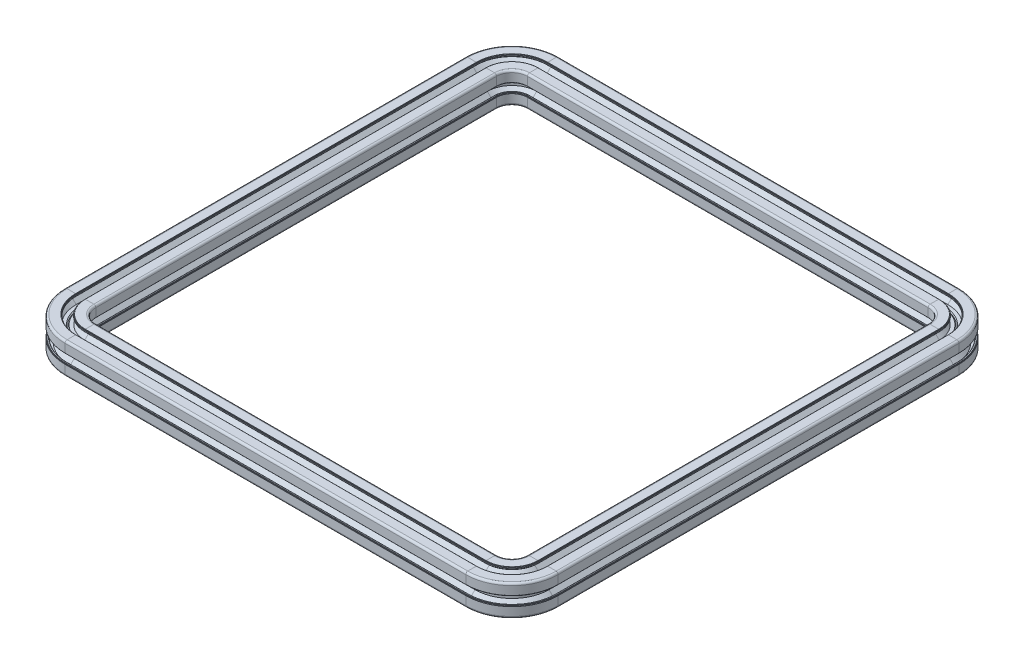
from build123d import *

# Parameters (mm, degrees)
SKETCH1_R                                      = 3.65
C_PROGRAM_FILES_SOLIDWORKS_CORP_SOLIDWOR_DEPTH = 390
SKETCH1_ON_SEGMENT_2_R                         = 3.65
C_PROGRAM_FILES_SOLIDWORKS_CORP_SOLI_2_ANGLE   = 90
SKETCH1_ON_SEGMENT_3_R                         = 3.65
C_PROGRAM_FILES_SOLIDWORKS_CORP_SOLI_3_DEPTH   = 390
SKETCH1_ON_SEGMENT_4_R                         = 3.65
C_PROGRAM_FILES_SOLIDWORKS_CORP_SOLI_4_ANGLE   = 90
SKETCH1_ON_SEGMENT_5_R                         = 3.65
C_PROGRAM_FILES_SOLIDWORKS_CORP_SOLI_5_DEPTH   = 390
SKETCH1_ON_SEGMENT_6_R                         = 3.65
C_PROGRAM_FILES_SOLIDWORKS_CORP_SOLI_6_ANGLE   = 90
SKETCH1_ON_SEGMENT_7_R                         = 3.65
C_PROGRAM_FILES_SOLIDWORKS_CORP_SOLI_7_DEPTH   = 390
SKETCH1_ON_SEGMENT_8_R                         = 3.65
C_PROGRAM_FILES_SOLIDWORKS_CORP_SOLI_8_ANGLE   = 90


with BuildPart() as part:
    # Sketch1 → C_PROGRAM FILES_SOLIDWORKS CORP_SOLIDWOR (new body)
    with BuildSketch(Plane(origin=(-225, 0, -195), x_dir=(1, 0, 0), z_dir=(0, 0, 1))):
        with BuildLine():
            Line((-0.899999946, -6), (0, -5.484851837))
            Line((0, -5.484851837), (0.899999946, -6))
            Line((0.899999946, -6), (4.204466193, -6))
            Line((4.204466193, -6), (8.250000327, -10.049999237))
            Line((8.250000327, -10.049999237), (8.250000327, -12.599998834))
            ThreePointArc((8.250000327, -12.599998834), (8.191421565, -12.741420475), (8.049999924, -12.799999237))
            Line((8.049999924, -12.799999237), (4.650000197, -12.799999237))
            ThreePointArc((4.650000197, -12.799999237), (4.225735989, -12.975735226), (4.05, -13.399999434))
            Line((4.05, -13.399999434), (4.05, -14.299999626))
            ThreePointArc((4.05, -14.299999626), (4.108578753, -14.441421247), (4.250000374, -14.5))
            Line((4.250000374, -14.5), (4.350000144, -14.5))
            ThreePointArc((4.350000144, -14.5), (4.49142109, -14.558578474), (4.549999564, -14.69999942))
            Line((4.549999564, -14.69999942), (4.549999564, -14.799999619))
            ThreePointArc((4.549999564, -14.799999619), (4.60857832, -14.941421245), (4.749999945, -15))
            Line((4.749999945, -15), (13.000000346, -15))
            ThreePointArc((13.000000346, -15), (14.414213664, -14.414213664), (15, -13.000000346))
            Line((15, -13.000000346), (15, -4.749999521))
            ThreePointArc((15, -4.749999521), (14.941421273, -4.608577964), (14.799999716, -4.549999237))
            Line((14.799999716, -4.549999237), (14.700000611, -4.549999237))
            ThreePointArc((14.700000611, -4.549999237), (14.558579054, -4.49142051), (14.500000327, -4.349998953))
            Line((14.500000327, -4.349998953), (14.500000327, -4.249999521))
            ThreePointArc((14.500000327, -4.249999521), (14.4414216, -4.108577964), (14.300000043, -4.049999237))
            Line((14.300000043, -4.049999237), (13.39999994, -4.049999237))
            ThreePointArc((13.39999994, -4.049999237), (12.975735606, -4.225735278), (12.799999564, -4.649999613))
            Line((12.799999564, -4.649999613), (12.799999564, -8.049999716))
            ThreePointArc((12.799999564, -8.049999716), (12.741420837, -8.191421273), (12.59999928, -8.25))
            Line((12.59999928, -8.25), (10.049999564, -8.25))
            Line((10.049999564, -8.25), (6.00446543, -4.204465866))
            Line((6.00446543, -4.204465866), (6.00446543, -0.899999619))
            Line((6.00446543, -0.899999619), (5.484852164, 0))
            Line((5.484852164, 0), (6.00446543, 0.899999619))
            Line((6.00446543, 0.899999619), (6.00446543, 4.204465866))
            Line((6.00446543, 4.204465866), (10.049999564, 8.25))
            Line((10.049999564, 8.25), (12.59999928, 8.25))
            ThreePointArc((12.59999928, 8.25), (12.741420837, 8.191421273), (12.799999564, 8.049999716))
            Line((12.799999564, 8.049999716), (12.799999564, 4.649999613))
            ThreePointArc((12.799999564, 4.649999613), (12.975735606, 4.225735278), (13.39999994, 4.049999237))
            Line((13.39999994, 4.049999237), (14.300000043, 4.049999237))
            ThreePointArc((14.300000043, 4.049999237), (14.4414216, 4.108577964), (14.500000327, 4.249999521))
            Line((14.500000327, 4.249999521), (14.500000327, 4.349998953))
            ThreePointArc((14.500000327, 4.349998953), (14.558579054, 4.49142051), (14.700000611, 4.549999237))
            Line((14.700000611, 4.549999237), (14.799999716, 4.549999237))
            ThreePointArc((14.799999716, 4.549999237), (14.941421273, 4.608577964), (15, 4.749999521))
            Line((15, 4.749999521), (15, 13.000000346))
            ThreePointArc((15, 13.000000346), (14.414213664, 14.414213664), (13.000000346, 15))
            Line((13.000000346, 15), (4.749999945, 15))
            ThreePointArc((4.749999945, 15), (4.60857832, 14.941421245), (4.549999564, 14.799999619))
            Line((4.549999564, 14.799999619), (4.549999564, 14.69999942))
            ThreePointArc((4.549999564, 14.69999942), (4.49142109, 14.558578474), (4.350000144, 14.5))
            Line((4.350000144, 14.5), (4.250000374, 14.5))
            ThreePointArc((4.250000374, 14.5), (4.108578753, 14.441421247), (4.05, 14.299999626))
            Line((4.05, 14.299999626), (4.05, 13.399999434))
            ThreePointArc((4.05, 13.399999434), (4.225735989, 12.975735226), (4.650000197, 12.799999237))
            Line((4.650000197, 12.799999237), (8.049999924, 12.799999237))
            ThreePointArc((8.049999924, 12.799999237), (8.191421565, 12.741420475), (8.250000327, 12.599998834))
            Line((8.250000327, 12.599998834), (8.250000327, 10.049999237))
            Line((8.250000327, 10.049999237), (4.204466193, 6))
            Line((4.204466193, 6), (0.899999946, 6))
            Line((0.899999946, 6), (0, 5.484851837))
            Line((0, 5.484851837), (-0.899999946, 6))
            Line((-0.899999946, 6), (-4.204466193, 6))
            Line((-4.204466193, 6), (-8.250000327, 10.049999237))
            Line((-8.250000327, 10.049999237), (-8.250000327, 12.599998834))
            ThreePointArc((-8.250000327, 12.599998834), (-8.191421565, 12.741420475), (-8.049999924, 12.799999237))
            Line((-8.049999924, 12.799999237), (-4.650000197, 12.799999237))
            ThreePointArc((-4.650000197, 12.799999237), (-4.225735989, 12.975735226), (-4.05, 13.399999434))
            Line((-4.05, 13.399999434), (-4.05, 14.299999626))
            ThreePointArc((-4.05, 14.299999626), (-4.108578753, 14.441421247), (-4.250000374, 14.5))
            Line((-4.250000374, 14.5), (-4.350000144, 14.5))
            ThreePointArc((-4.350000144, 14.5), (-4.49142109, 14.558578474), (-4.549999564, 14.69999942))
            Line((-4.549999564, 14.69999942), (-4.549999564, 14.799999619))
            ThreePointArc((-4.549999564, 14.799999619), (-4.60857832, 14.941421245), (-4.749999945, 15))
            Line((-4.749999945, 15), (-13.000000346, 15))
            ThreePointArc((-13.000000346, 15), (-14.414213664, 14.414213664), (-15, 13.000000346))
            Line((-15, 13.000000346), (-15, 4.749999521))
            ThreePointArc((-15, 4.749999521), (-14.941421273, 4.608577964), (-14.799999716, 4.549999237))
            Line((-14.799999716, 4.549999237), (-14.700000611, 4.549999237))
            ThreePointArc((-14.700000611, 4.549999237), (-14.558579054, 4.49142051), (-14.500000327, 4.349998953))
            Line((-14.500000327, 4.349998953), (-14.500000327, 4.249999521))
            ThreePointArc((-14.500000327, 4.249999521), (-14.4414216, 4.108577964), (-14.300000043, 4.049999237))
            Line((-14.300000043, 4.049999237), (-13.39999994, 4.049999237))
            ThreePointArc((-13.39999994, 4.049999237), (-12.975735606, 4.225735278), (-12.799999564, 4.649999613))
            Line((-12.799999564, 4.649999613), (-12.799999564, 8.049999716))
            ThreePointArc((-12.799999564, 8.049999716), (-12.741420837, 8.191421273), (-12.59999928, 8.25))
            Line((-12.59999928, 8.25), (-10.049999564, 8.25))
            Line((-10.049999564, 8.25), (-6.00446543, 4.204465866))
            Line((-6.00446543, 4.204465866), (-6.00446543, 0.899999619))
            Line((-6.00446543, 0.899999619), (-5.484852164, 0))
            Line((-5.484852164, 0), (-6.00446543, -0.899999619))
            Line((-6.00446543, -0.899999619), (-6.00446543, -4.204465866))
            Line((-6.00446543, -4.204465866), (-10.049999564, -8.25))
            Line((-10.049999564, -8.25), (-12.59999928, -8.25))
            ThreePointArc((-12.59999928, -8.25), (-12.741420837, -8.191421273), (-12.799999564, -8.049999716))
            Line((-12.799999564, -8.049999716), (-12.799999564, -4.649999613))
            ThreePointArc((-12.799999564, -4.649999613), (-12.975735606, -4.225735278), (-13.39999994, -4.049999237))
            Line((-13.39999994, -4.049999237), (-14.300000043, -4.049999237))
            ThreePointArc((-14.300000043, -4.049999237), (-14.4414216, -4.108577964), (-14.500000327, -4.249999521))
            Line((-14.500000327, -4.249999521), (-14.500000327, -4.349998953))
            ThreePointArc((-14.500000327, -4.349998953), (-14.558579054, -4.49142051), (-14.700000611, -4.549999237))
            Line((-14.700000611, -4.549999237), (-14.799999716, -4.549999237))
            ThreePointArc((-14.799999716, -4.549999237), (-14.941421273, -4.608577964), (-15, -4.749999521))
            Line((-15, -4.749999521), (-15, -13.000000346))
            ThreePointArc((-15, -13.000000346), (-14.414213664, -14.414213664), (-13.000000346, -15))
            Line((-13.000000346, -15), (-4.749999945, -15))
            ThreePointArc((-4.749999945, -15), (-4.60857832, -14.941421245), (-4.549999564, -14.799999619))
            Line((-4.549999564, -14.799999619), (-4.549999564, -14.69999942))
            ThreePointArc((-4.549999564, -14.69999942), (-4.49142109, -14.558578474), (-4.350000144, -14.5))
            Line((-4.350000144, -14.5), (-4.250000374, -14.5))
            ThreePointArc((-4.250000374, -14.5), (-4.108578753, -14.441421247), (-4.05, -14.299999626))
            Line((-4.05, -14.299999626), (-4.05, -13.399999434))
            ThreePointArc((-4.05, -13.399999434), (-4.225735989, -12.975735226), (-4.650000197, -12.799999237))
            Line((-4.650000197, -12.799999237), (-8.049999924, -12.799999237))
            ThreePointArc((-8.049999924, -12.799999237), (-8.191421565, -12.741420475), (-8.250000327, -12.599998834))
            Line((-8.250000327, -12.599998834), (-8.250000327, -10.049999237))
            Line((-8.250000327, -10.049999237), (-4.204466193, -6))
            Line((-4.204466193, -6), (-0.899999946, -6))
        make_face()
        Circle(SKETCH1_R, mode=Mode.SUBTRACT)
    extrude(amount=C_PROGRAM_FILES_SOLIDWORKS_CORP_SOLIDWOR_DEPTH)


with BuildPart() as body_2:
    # Sketch1 on segment 2 (carried to the start of arc 2) → C_PROGRAM FILES_SOLIDWORKS CORP_SOLI 2 (revolve)
    with BuildSketch(Plane(origin=(-195, 0, 225), x_dir=(0, 0, 1), z_dir=(-1, 0, 0))):
        with BuildLine():
            Line((-0.899999946, -6), (0, -5.484851837))
            Line((0, -5.484851837), (0.899999946, -6))
            Line((0.899999946, -6), (4.204466193, -6))
            Line((4.204466193, -6), (8.250000327, -10.049999237))
            Line((8.250000327, -10.049999237), (8.250000327, -12.599998834))
            ThreePointArc((8.250000327, -12.599998834), (8.191421565, -12.741420475), (8.049999924, -12.799999237))
            Line((8.049999924, -12.799999237), (4.650000197, -12.799999237))
            ThreePointArc((4.650000197, -12.799999237), (4.225735989, -12.975735226), (4.05, -13.399999434))
            Line((4.05, -13.399999434), (4.05, -14.299999626))
            ThreePointArc((4.05, -14.299999626), (4.108578753, -14.441421247), (4.250000374, -14.5))
            Line((4.250000374, -14.5), (4.350000144, -14.5))
            ThreePointArc((4.350000144, -14.5), (4.49142109, -14.558578474), (4.549999564, -14.69999942))
            Line((4.549999564, -14.69999942), (4.549999564, -14.799999619))
            ThreePointArc((4.549999564, -14.799999619), (4.60857832, -14.941421245), (4.749999945, -15))
            Line((4.749999945, -15), (13.000000346, -15))
            ThreePointArc((13.000000346, -15), (14.414213664, -14.414213664), (15, -13.000000346))
            Line((15, -13.000000346), (15, -4.749999521))
            ThreePointArc((15, -4.749999521), (14.941421273, -4.608577964), (14.799999716, -4.549999237))
            Line((14.799999716, -4.549999237), (14.700000611, -4.549999237))
            ThreePointArc((14.700000611, -4.549999237), (14.558579054, -4.49142051), (14.500000327, -4.349998953))
            Line((14.500000327, -4.349998953), (14.500000327, -4.249999521))
            ThreePointArc((14.500000327, -4.249999521), (14.4414216, -4.108577964), (14.300000043, -4.049999237))
            Line((14.300000043, -4.049999237), (13.39999994, -4.049999237))
            ThreePointArc((13.39999994, -4.049999237), (12.975735606, -4.225735278), (12.799999564, -4.649999613))
            Line((12.799999564, -4.649999613), (12.799999564, -8.049999716))
            ThreePointArc((12.799999564, -8.049999716), (12.741420837, -8.191421273), (12.59999928, -8.25))
            Line((12.59999928, -8.25), (10.049999564, -8.25))
            Line((10.049999564, -8.25), (6.00446543, -4.204465866))
            Line((6.00446543, -4.204465866), (6.00446543, -0.899999619))
            Line((6.00446543, -0.899999619), (5.484852164, 0))
            Line((5.484852164, 0), (6.00446543, 0.899999619))
            Line((6.00446543, 0.899999619), (6.00446543, 4.204465866))
            Line((6.00446543, 4.204465866), (10.049999564, 8.25))
            Line((10.049999564, 8.25), (12.59999928, 8.25))
            ThreePointArc((12.59999928, 8.25), (12.741420837, 8.191421273), (12.799999564, 8.049999716))
            Line((12.799999564, 8.049999716), (12.799999564, 4.649999613))
            ThreePointArc((12.799999564, 4.649999613), (12.975735606, 4.225735278), (13.39999994, 4.049999237))
            Line((13.39999994, 4.049999237), (14.300000043, 4.049999237))
            ThreePointArc((14.300000043, 4.049999237), (14.4414216, 4.108577964), (14.500000327, 4.249999521))
            Line((14.500000327, 4.249999521), (14.500000327, 4.349998953))
            ThreePointArc((14.500000327, 4.349998953), (14.558579054, 4.49142051), (14.700000611, 4.549999237))
            Line((14.700000611, 4.549999237), (14.799999716, 4.549999237))
            ThreePointArc((14.799999716, 4.549999237), (14.941421273, 4.608577964), (15, 4.749999521))
            Line((15, 4.749999521), (15, 13.000000346))
            ThreePointArc((15, 13.000000346), (14.414213664, 14.414213664), (13.000000346, 15))
            Line((13.000000346, 15), (4.749999945, 15))
            ThreePointArc((4.749999945, 15), (4.60857832, 14.941421245), (4.549999564, 14.799999619))
            Line((4.549999564, 14.799999619), (4.549999564, 14.69999942))
            ThreePointArc((4.549999564, 14.69999942), (4.49142109, 14.558578474), (4.350000144, 14.5))
            Line((4.350000144, 14.5), (4.250000374, 14.5))
            ThreePointArc((4.250000374, 14.5), (4.108578753, 14.441421247), (4.05, 14.299999626))
            Line((4.05, 14.299999626), (4.05, 13.399999434))
            ThreePointArc((4.05, 13.399999434), (4.225735989, 12.975735226), (4.650000197, 12.799999237))
            Line((4.650000197, 12.799999237), (8.049999924, 12.799999237))
            ThreePointArc((8.049999924, 12.799999237), (8.191421565, 12.741420475), (8.250000327, 12.599998834))
            Line((8.250000327, 12.599998834), (8.250000327, 10.049999237))
            Line((8.250000327, 10.049999237), (4.204466193, 6))
            Line((4.204466193, 6), (0.899999946, 6))
            Line((0.899999946, 6), (0, 5.484851837))
            Line((0, 5.484851837), (-0.899999946, 6))
            Line((-0.899999946, 6), (-4.204466193, 6))
            Line((-4.204466193, 6), (-8.250000327, 10.049999237))
            Line((-8.250000327, 10.049999237), (-8.250000327, 12.599998834))
            ThreePointArc((-8.250000327, 12.599998834), (-8.191421565, 12.741420475), (-8.049999924, 12.799999237))
            Line((-8.049999924, 12.799999237), (-4.650000197, 12.799999237))
            ThreePointArc((-4.650000197, 12.799999237), (-4.225735989, 12.975735226), (-4.05, 13.399999434))
            Line((-4.05, 13.399999434), (-4.05, 14.299999626))
            ThreePointArc((-4.05, 14.299999626), (-4.108578753, 14.441421247), (-4.250000374, 14.5))
            Line((-4.250000374, 14.5), (-4.350000144, 14.5))
            ThreePointArc((-4.350000144, 14.5), (-4.49142109, 14.558578474), (-4.549999564, 14.69999942))
            Line((-4.549999564, 14.69999942), (-4.549999564, 14.799999619))
            ThreePointArc((-4.549999564, 14.799999619), (-4.60857832, 14.941421245), (-4.749999945, 15))
            Line((-4.749999945, 15), (-13.000000346, 15))
            ThreePointArc((-13.000000346, 15), (-14.414213664, 14.414213664), (-15, 13.000000346))
            Line((-15, 13.000000346), (-15, 4.749999521))
            ThreePointArc((-15, 4.749999521), (-14.941421273, 4.608577964), (-14.799999716, 4.549999237))
            Line((-14.799999716, 4.549999237), (-14.700000611, 4.549999237))
            ThreePointArc((-14.700000611, 4.549999237), (-14.558579054, 4.49142051), (-14.500000327, 4.349998953))
            Line((-14.500000327, 4.349998953), (-14.500000327, 4.249999521))
            ThreePointArc((-14.500000327, 4.249999521), (-14.4414216, 4.108577964), (-14.300000043, 4.049999237))
            Line((-14.300000043, 4.049999237), (-13.39999994, 4.049999237))
            ThreePointArc((-13.39999994, 4.049999237), (-12.975735606, 4.225735278), (-12.799999564, 4.649999613))
            Line((-12.799999564, 4.649999613), (-12.799999564, 8.049999716))
            ThreePointArc((-12.799999564, 8.049999716), (-12.741420837, 8.191421273), (-12.59999928, 8.25))
            Line((-12.59999928, 8.25), (-10.049999564, 8.25))
            Line((-10.049999564, 8.25), (-6.00446543, 4.204465866))
            Line((-6.00446543, 4.204465866), (-6.00446543, 0.899999619))
            Line((-6.00446543, 0.899999619), (-5.484852164, 0))
            Line((-5.484852164, 0), (-6.00446543, -0.899999619))
            Line((-6.00446543, -0.899999619), (-6.00446543, -4.204465866))
            Line((-6.00446543, -4.204465866), (-10.049999564, -8.25))
            Line((-10.049999564, -8.25), (-12.59999928, -8.25))
            ThreePointArc((-12.59999928, -8.25), (-12.741420837, -8.191421273), (-12.799999564, -8.049999716))
            Line((-12.799999564, -8.049999716), (-12.799999564, -4.649999613))
            ThreePointArc((-12.799999564, -4.649999613), (-12.975735606, -4.225735278), (-13.39999994, -4.049999237))
            Line((-13.39999994, -4.049999237), (-14.300000043, -4.049999237))
            ThreePointArc((-14.300000043, -4.049999237), (-14.4414216, -4.108577964), (-14.500000327, -4.249999521))
            Line((-14.500000327, -4.249999521), (-14.500000327, -4.349998953))
            ThreePointArc((-14.500000327, -4.349998953), (-14.558579054, -4.49142051), (-14.700000611, -4.549999237))
            Line((-14.700000611, -4.549999237), (-14.799999716, -4.549999237))
            ThreePointArc((-14.799999716, -4.549999237), (-14.941421273, -4.608577964), (-15, -4.749999521))
            Line((-15, -4.749999521), (-15, -13.000000346))
            ThreePointArc((-15, -13.000000346), (-14.414213664, -14.414213664), (-13.000000346, -15))
            Line((-13.000000346, -15), (-4.749999945, -15))
            ThreePointArc((-4.749999945, -15), (-4.60857832, -14.941421245), (-4.549999564, -14.799999619))
            Line((-4.549999564, -14.799999619), (-4.549999564, -14.69999942))
            ThreePointArc((-4.549999564, -14.69999942), (-4.49142109, -14.558578474), (-4.350000144, -14.5))
            Line((-4.350000144, -14.5), (-4.250000374, -14.5))
            ThreePointArc((-4.250000374, -14.5), (-4.108578753, -14.441421247), (-4.05, -14.299999626))
            Line((-4.05, -14.299999626), (-4.05, -13.399999434))
            ThreePointArc((-4.05, -13.399999434), (-4.225735989, -12.975735226), (-4.650000197, -12.799999237))
            Line((-4.650000197, -12.799999237), (-8.049999924, -12.799999237))
            ThreePointArc((-8.049999924, -12.799999237), (-8.191421565, -12.741420475), (-8.250000327, -12.599998834))
            Line((-8.250000327, -12.599998834), (-8.250000327, -10.049999237))
            Line((-8.250000327, -10.049999237), (-4.204466193, -6))
            Line((-4.204466193, -6), (-0.899999946, -6))
        make_face()
        Circle(SKETCH1_ON_SEGMENT_2_R, mode=Mode.SUBTRACT)
    revolve(axis=Axis((-195, 0, 195), (0, -1, 0)), revolution_arc=C_PROGRAM_FILES_SOLIDWORKS_CORP_SOLI_2_ANGLE)


with BuildPart() as body_3:
    # Sketch1 on segment 3 (carried to segment 3) → C_PROGRAM FILES_SOLIDWORKS CORP_SOLI 3 (new body)
    with BuildSketch(Plane(origin=(-195, 0, 225), x_dir=(0, 0, -1), z_dir=(1, 0, 0))):
        with BuildLine():
            Line((-0.899999946, -6), (0, -5.484851837))
            Line((0, -5.484851837), (0.899999946, -6))
            Line((0.899999946, -6), (4.204466193, -6))
            Line((4.204466193, -6), (8.250000327, -10.049999237))
            Line((8.250000327, -10.049999237), (8.250000327, -12.599998834))
            ThreePointArc((8.250000327, -12.599998834), (8.191421565, -12.741420475), (8.049999924, -12.799999237))
            Line((8.049999924, -12.799999237), (4.650000197, -12.799999237))
            ThreePointArc((4.650000197, -12.799999237), (4.225735989, -12.975735226), (4.05, -13.399999434))
            Line((4.05, -13.399999434), (4.05, -14.299999626))
            ThreePointArc((4.05, -14.299999626), (4.108578753, -14.441421247), (4.250000374, -14.5))
            Line((4.250000374, -14.5), (4.350000144, -14.5))
            ThreePointArc((4.350000144, -14.5), (4.49142109, -14.558578474), (4.549999564, -14.69999942))
            Line((4.549999564, -14.69999942), (4.549999564, -14.799999619))
            ThreePointArc((4.549999564, -14.799999619), (4.60857832, -14.941421245), (4.749999945, -15))
            Line((4.749999945, -15), (13.000000346, -15))
            ThreePointArc((13.000000346, -15), (14.414213664, -14.414213664), (15, -13.000000346))
            Line((15, -13.000000346), (15, -4.749999521))
            ThreePointArc((15, -4.749999521), (14.941421273, -4.608577964), (14.799999716, -4.549999237))
            Line((14.799999716, -4.549999237), (14.700000611, -4.549999237))
            ThreePointArc((14.700000611, -4.549999237), (14.558579054, -4.49142051), (14.500000327, -4.349998953))
            Line((14.500000327, -4.349998953), (14.500000327, -4.249999521))
            ThreePointArc((14.500000327, -4.249999521), (14.4414216, -4.108577964), (14.300000043, -4.049999237))
            Line((14.300000043, -4.049999237), (13.39999994, -4.049999237))
            ThreePointArc((13.39999994, -4.049999237), (12.975735606, -4.225735278), (12.799999564, -4.649999613))
            Line((12.799999564, -4.649999613), (12.799999564, -8.049999716))
            ThreePointArc((12.799999564, -8.049999716), (12.741420837, -8.191421273), (12.59999928, -8.25))
            Line((12.59999928, -8.25), (10.049999564, -8.25))
            Line((10.049999564, -8.25), (6.00446543, -4.204465866))
            Line((6.00446543, -4.204465866), (6.00446543, -0.899999619))
            Line((6.00446543, -0.899999619), (5.484852164, 0))
            Line((5.484852164, 0), (6.00446543, 0.899999619))
            Line((6.00446543, 0.899999619), (6.00446543, 4.204465866))
            Line((6.00446543, 4.204465866), (10.049999564, 8.25))
            Line((10.049999564, 8.25), (12.59999928, 8.25))
            ThreePointArc((12.59999928, 8.25), (12.741420837, 8.191421273), (12.799999564, 8.049999716))
            Line((12.799999564, 8.049999716), (12.799999564, 4.649999613))
            ThreePointArc((12.799999564, 4.649999613), (12.975735606, 4.225735278), (13.39999994, 4.049999237))
            Line((13.39999994, 4.049999237), (14.300000043, 4.049999237))
            ThreePointArc((14.300000043, 4.049999237), (14.4414216, 4.108577964), (14.500000327, 4.249999521))
            Line((14.500000327, 4.249999521), (14.500000327, 4.349998953))
            ThreePointArc((14.500000327, 4.349998953), (14.558579054, 4.49142051), (14.700000611, 4.549999237))
            Line((14.700000611, 4.549999237), (14.799999716, 4.549999237))
            ThreePointArc((14.799999716, 4.549999237), (14.941421273, 4.608577964), (15, 4.749999521))
            Line((15, 4.749999521), (15, 13.000000346))
            ThreePointArc((15, 13.000000346), (14.414213664, 14.414213664), (13.000000346, 15))
            Line((13.000000346, 15), (4.749999945, 15))
            ThreePointArc((4.749999945, 15), (4.60857832, 14.941421245), (4.549999564, 14.799999619))
            Line((4.549999564, 14.799999619), (4.549999564, 14.69999942))
            ThreePointArc((4.549999564, 14.69999942), (4.49142109, 14.558578474), (4.350000144, 14.5))
            Line((4.350000144, 14.5), (4.250000374, 14.5))
            ThreePointArc((4.250000374, 14.5), (4.108578753, 14.441421247), (4.05, 14.299999626))
            Line((4.05, 14.299999626), (4.05, 13.399999434))
            ThreePointArc((4.05, 13.399999434), (4.225735989, 12.975735226), (4.650000197, 12.799999237))
            Line((4.650000197, 12.799999237), (8.049999924, 12.799999237))
            ThreePointArc((8.049999924, 12.799999237), (8.191421565, 12.741420475), (8.250000327, 12.599998834))
            Line((8.250000327, 12.599998834), (8.250000327, 10.049999237))
            Line((8.250000327, 10.049999237), (4.204466193, 6))
            Line((4.204466193, 6), (0.899999946, 6))
            Line((0.899999946, 6), (0, 5.484851837))
            Line((0, 5.484851837), (-0.899999946, 6))
            Line((-0.899999946, 6), (-4.204466193, 6))
            Line((-4.204466193, 6), (-8.250000327, 10.049999237))
            Line((-8.250000327, 10.049999237), (-8.250000327, 12.599998834))
            ThreePointArc((-8.250000327, 12.599998834), (-8.191421565, 12.741420475), (-8.049999924, 12.799999237))
            Line((-8.049999924, 12.799999237), (-4.650000197, 12.799999237))
            ThreePointArc((-4.650000197, 12.799999237), (-4.225735989, 12.975735226), (-4.05, 13.399999434))
            Line((-4.05, 13.399999434), (-4.05, 14.299999626))
            ThreePointArc((-4.05, 14.299999626), (-4.108578753, 14.441421247), (-4.250000374, 14.5))
            Line((-4.250000374, 14.5), (-4.350000144, 14.5))
            ThreePointArc((-4.350000144, 14.5), (-4.49142109, 14.558578474), (-4.549999564, 14.69999942))
            Line((-4.549999564, 14.69999942), (-4.549999564, 14.799999619))
            ThreePointArc((-4.549999564, 14.799999619), (-4.60857832, 14.941421245), (-4.749999945, 15))
            Line((-4.749999945, 15), (-13.000000346, 15))
            ThreePointArc((-13.000000346, 15), (-14.414213664, 14.414213664), (-15, 13.000000346))
            Line((-15, 13.000000346), (-15, 4.749999521))
            ThreePointArc((-15, 4.749999521), (-14.941421273, 4.608577964), (-14.799999716, 4.549999237))
            Line((-14.799999716, 4.549999237), (-14.700000611, 4.549999237))
            ThreePointArc((-14.700000611, 4.549999237), (-14.558579054, 4.49142051), (-14.500000327, 4.349998953))
            Line((-14.500000327, 4.349998953), (-14.500000327, 4.249999521))
            ThreePointArc((-14.500000327, 4.249999521), (-14.4414216, 4.108577964), (-14.300000043, 4.049999237))
            Line((-14.300000043, 4.049999237), (-13.39999994, 4.049999237))
            ThreePointArc((-13.39999994, 4.049999237), (-12.975735606, 4.225735278), (-12.799999564, 4.649999613))
            Line((-12.799999564, 4.649999613), (-12.799999564, 8.049999716))
            ThreePointArc((-12.799999564, 8.049999716), (-12.741420837, 8.191421273), (-12.59999928, 8.25))
            Line((-12.59999928, 8.25), (-10.049999564, 8.25))
            Line((-10.049999564, 8.25), (-6.00446543, 4.204465866))
            Line((-6.00446543, 4.204465866), (-6.00446543, 0.899999619))
            Line((-6.00446543, 0.899999619), (-5.484852164, 0))
            Line((-5.484852164, 0), (-6.00446543, -0.899999619))
            Line((-6.00446543, -0.899999619), (-6.00446543, -4.204465866))
            Line((-6.00446543, -4.204465866), (-10.049999564, -8.25))
            Line((-10.049999564, -8.25), (-12.59999928, -8.25))
            ThreePointArc((-12.59999928, -8.25), (-12.741420837, -8.191421273), (-12.799999564, -8.049999716))
            Line((-12.799999564, -8.049999716), (-12.799999564, -4.649999613))
            ThreePointArc((-12.799999564, -4.649999613), (-12.975735606, -4.225735278), (-13.39999994, -4.049999237))
            Line((-13.39999994, -4.049999237), (-14.300000043, -4.049999237))
            ThreePointArc((-14.300000043, -4.049999237), (-14.4414216, -4.108577964), (-14.500000327, -4.249999521))
            Line((-14.500000327, -4.249999521), (-14.500000327, -4.349998953))
            ThreePointArc((-14.500000327, -4.349998953), (-14.558579054, -4.49142051), (-14.700000611, -4.549999237))
            Line((-14.700000611, -4.549999237), (-14.799999716, -4.549999237))
            ThreePointArc((-14.799999716, -4.549999237), (-14.941421273, -4.608577964), (-15, -4.749999521))
            Line((-15, -4.749999521), (-15, -13.000000346))
            ThreePointArc((-15, -13.000000346), (-14.414213664, -14.414213664), (-13.000000346, -15))
            Line((-13.000000346, -15), (-4.749999945, -15))
            ThreePointArc((-4.749999945, -15), (-4.60857832, -14.941421245), (-4.549999564, -14.799999619))
            Line((-4.549999564, -14.799999619), (-4.549999564, -14.69999942))
            ThreePointArc((-4.549999564, -14.69999942), (-4.49142109, -14.558578474), (-4.350000144, -14.5))
            Line((-4.350000144, -14.5), (-4.250000374, -14.5))
            ThreePointArc((-4.250000374, -14.5), (-4.108578753, -14.441421247), (-4.05, -14.299999626))
            Line((-4.05, -14.299999626), (-4.05, -13.399999434))
            ThreePointArc((-4.05, -13.399999434), (-4.225735989, -12.975735226), (-4.650000197, -12.799999237))
            Line((-4.650000197, -12.799999237), (-8.049999924, -12.799999237))
            ThreePointArc((-8.049999924, -12.799999237), (-8.191421565, -12.741420475), (-8.250000327, -12.599998834))
            Line((-8.250000327, -12.599998834), (-8.250000327, -10.049999237))
            Line((-8.250000327, -10.049999237), (-4.204466193, -6))
            Line((-4.204466193, -6), (-0.899999946, -6))
        make_face()
        Circle(SKETCH1_ON_SEGMENT_3_R, mode=Mode.SUBTRACT)
    extrude(amount=C_PROGRAM_FILES_SOLIDWORKS_CORP_SOLI_3_DEPTH)


with BuildPart() as body_4:
    # Sketch1 on segment 4 (carried to the start of arc 4) → C_PROGRAM FILES_SOLIDWORKS CORP_SOLI 4 (revolve)
    with BuildSketch(Plane(origin=(225, 0, 195), x_dir=(1, 0, 0), z_dir=(0, 0, 1))):
        with BuildLine():
            Line((-0.899999946, -6), (0, -5.484851837))
            Line((0, -5.484851837), (0.899999946, -6))
            Line((0.899999946, -6), (4.204466193, -6))
            Line((4.204466193, -6), (8.250000327, -10.049999237))
            Line((8.250000327, -10.049999237), (8.250000327, -12.599998834))
            ThreePointArc((8.250000327, -12.599998834), (8.191421565, -12.741420475), (8.049999924, -12.799999237))
            Line((8.049999924, -12.799999237), (4.650000197, -12.799999237))
            ThreePointArc((4.650000197, -12.799999237), (4.225735989, -12.975735226), (4.05, -13.399999434))
            Line((4.05, -13.399999434), (4.05, -14.299999626))
            ThreePointArc((4.05, -14.299999626), (4.108578753, -14.441421247), (4.250000374, -14.5))
            Line((4.250000374, -14.5), (4.350000144, -14.5))
            ThreePointArc((4.350000144, -14.5), (4.49142109, -14.558578474), (4.549999564, -14.69999942))
            Line((4.549999564, -14.69999942), (4.549999564, -14.799999619))
            ThreePointArc((4.549999564, -14.799999619), (4.60857832, -14.941421245), (4.749999945, -15))
            Line((4.749999945, -15), (13.000000346, -15))
            ThreePointArc((13.000000346, -15), (14.414213664, -14.414213664), (15, -13.000000346))
            Line((15, -13.000000346), (15, -4.749999521))
            ThreePointArc((15, -4.749999521), (14.941421273, -4.608577964), (14.799999716, -4.549999237))
            Line((14.799999716, -4.549999237), (14.700000611, -4.549999237))
            ThreePointArc((14.700000611, -4.549999237), (14.558579054, -4.49142051), (14.500000327, -4.349998953))
            Line((14.500000327, -4.349998953), (14.500000327, -4.249999521))
            ThreePointArc((14.500000327, -4.249999521), (14.4414216, -4.108577964), (14.300000043, -4.049999237))
            Line((14.300000043, -4.049999237), (13.39999994, -4.049999237))
            ThreePointArc((13.39999994, -4.049999237), (12.975735606, -4.225735278), (12.799999564, -4.649999613))
            Line((12.799999564, -4.649999613), (12.799999564, -8.049999716))
            ThreePointArc((12.799999564, -8.049999716), (12.741420837, -8.191421273), (12.59999928, -8.25))
            Line((12.59999928, -8.25), (10.049999564, -8.25))
            Line((10.049999564, -8.25), (6.00446543, -4.204465866))
            Line((6.00446543, -4.204465866), (6.00446543, -0.899999619))
            Line((6.00446543, -0.899999619), (5.484852164, 0))
            Line((5.484852164, 0), (6.00446543, 0.899999619))
            Line((6.00446543, 0.899999619), (6.00446543, 4.204465866))
            Line((6.00446543, 4.204465866), (10.049999564, 8.25))
            Line((10.049999564, 8.25), (12.59999928, 8.25))
            ThreePointArc((12.59999928, 8.25), (12.741420837, 8.191421273), (12.799999564, 8.049999716))
            Line((12.799999564, 8.049999716), (12.799999564, 4.649999613))
            ThreePointArc((12.799999564, 4.649999613), (12.975735606, 4.225735278), (13.39999994, 4.049999237))
            Line((13.39999994, 4.049999237), (14.300000043, 4.049999237))
            ThreePointArc((14.300000043, 4.049999237), (14.4414216, 4.108577964), (14.500000327, 4.249999521))
            Line((14.500000327, 4.249999521), (14.500000327, 4.349998953))
            ThreePointArc((14.500000327, 4.349998953), (14.558579054, 4.49142051), (14.700000611, 4.549999237))
            Line((14.700000611, 4.549999237), (14.799999716, 4.549999237))
            ThreePointArc((14.799999716, 4.549999237), (14.941421273, 4.608577964), (15, 4.749999521))
            Line((15, 4.749999521), (15, 13.000000346))
            ThreePointArc((15, 13.000000346), (14.414213664, 14.414213664), (13.000000346, 15))
            Line((13.000000346, 15), (4.749999945, 15))
            ThreePointArc((4.749999945, 15), (4.60857832, 14.941421245), (4.549999564, 14.799999619))
            Line((4.549999564, 14.799999619), (4.549999564, 14.69999942))
            ThreePointArc((4.549999564, 14.69999942), (4.49142109, 14.558578474), (4.350000144, 14.5))
            Line((4.350000144, 14.5), (4.250000374, 14.5))
            ThreePointArc((4.250000374, 14.5), (4.108578753, 14.441421247), (4.05, 14.299999626))
            Line((4.05, 14.299999626), (4.05, 13.399999434))
            ThreePointArc((4.05, 13.399999434), (4.225735989, 12.975735226), (4.650000197, 12.799999237))
            Line((4.650000197, 12.799999237), (8.049999924, 12.799999237))
            ThreePointArc((8.049999924, 12.799999237), (8.191421565, 12.741420475), (8.250000327, 12.599998834))
            Line((8.250000327, 12.599998834), (8.250000327, 10.049999237))
            Line((8.250000327, 10.049999237), (4.204466193, 6))
            Line((4.204466193, 6), (0.899999946, 6))
            Line((0.899999946, 6), (0, 5.484851837))
            Line((0, 5.484851837), (-0.899999946, 6))
            Line((-0.899999946, 6), (-4.204466193, 6))
            Line((-4.204466193, 6), (-8.250000327, 10.049999237))
            Line((-8.250000327, 10.049999237), (-8.250000327, 12.599998834))
            ThreePointArc((-8.250000327, 12.599998834), (-8.191421565, 12.741420475), (-8.049999924, 12.799999237))
            Line((-8.049999924, 12.799999237), (-4.650000197, 12.799999237))
            ThreePointArc((-4.650000197, 12.799999237), (-4.225735989, 12.975735226), (-4.05, 13.399999434))
            Line((-4.05, 13.399999434), (-4.05, 14.299999626))
            ThreePointArc((-4.05, 14.299999626), (-4.108578753, 14.441421247), (-4.250000374, 14.5))
            Line((-4.250000374, 14.5), (-4.350000144, 14.5))
            ThreePointArc((-4.350000144, 14.5), (-4.49142109, 14.558578474), (-4.549999564, 14.69999942))
            Line((-4.549999564, 14.69999942), (-4.549999564, 14.799999619))
            ThreePointArc((-4.549999564, 14.799999619), (-4.60857832, 14.941421245), (-4.749999945, 15))
            Line((-4.749999945, 15), (-13.000000346, 15))
            ThreePointArc((-13.000000346, 15), (-14.414213664, 14.414213664), (-15, 13.000000346))
            Line((-15, 13.000000346), (-15, 4.749999521))
            ThreePointArc((-15, 4.749999521), (-14.941421273, 4.608577964), (-14.799999716, 4.549999237))
            Line((-14.799999716, 4.549999237), (-14.700000611, 4.549999237))
            ThreePointArc((-14.700000611, 4.549999237), (-14.558579054, 4.49142051), (-14.500000327, 4.349998953))
            Line((-14.500000327, 4.349998953), (-14.500000327, 4.249999521))
            ThreePointArc((-14.500000327, 4.249999521), (-14.4414216, 4.108577964), (-14.300000043, 4.049999237))
            Line((-14.300000043, 4.049999237), (-13.39999994, 4.049999237))
            ThreePointArc((-13.39999994, 4.049999237), (-12.975735606, 4.225735278), (-12.799999564, 4.649999613))
            Line((-12.799999564, 4.649999613), (-12.799999564, 8.049999716))
            ThreePointArc((-12.799999564, 8.049999716), (-12.741420837, 8.191421273), (-12.59999928, 8.25))
            Line((-12.59999928, 8.25), (-10.049999564, 8.25))
            Line((-10.049999564, 8.25), (-6.00446543, 4.204465866))
            Line((-6.00446543, 4.204465866), (-6.00446543, 0.899999619))
            Line((-6.00446543, 0.899999619), (-5.484852164, 0))
            Line((-5.484852164, 0), (-6.00446543, -0.899999619))
            Line((-6.00446543, -0.899999619), (-6.00446543, -4.204465866))
            Line((-6.00446543, -4.204465866), (-10.049999564, -8.25))
            Line((-10.049999564, -8.25), (-12.59999928, -8.25))
            ThreePointArc((-12.59999928, -8.25), (-12.741420837, -8.191421273), (-12.799999564, -8.049999716))
            Line((-12.799999564, -8.049999716), (-12.799999564, -4.649999613))
            ThreePointArc((-12.799999564, -4.649999613), (-12.975735606, -4.225735278), (-13.39999994, -4.049999237))
            Line((-13.39999994, -4.049999237), (-14.300000043, -4.049999237))
            ThreePointArc((-14.300000043, -4.049999237), (-14.4414216, -4.108577964), (-14.500000327, -4.249999521))
            Line((-14.500000327, -4.249999521), (-14.500000327, -4.349998953))
            ThreePointArc((-14.500000327, -4.349998953), (-14.558579054, -4.49142051), (-14.700000611, -4.549999237))
            Line((-14.700000611, -4.549999237), (-14.799999716, -4.549999237))
            ThreePointArc((-14.799999716, -4.549999237), (-14.941421273, -4.608577964), (-15, -4.749999521))
            Line((-15, -4.749999521), (-15, -13.000000346))
            ThreePointArc((-15, -13.000000346), (-14.414213664, -14.414213664), (-13.000000346, -15))
            Line((-13.000000346, -15), (-4.749999945, -15))
            ThreePointArc((-4.749999945, -15), (-4.60857832, -14.941421245), (-4.549999564, -14.799999619))
            Line((-4.549999564, -14.799999619), (-4.549999564, -14.69999942))
            ThreePointArc((-4.549999564, -14.69999942), (-4.49142109, -14.558578474), (-4.350000144, -14.5))
            Line((-4.350000144, -14.5), (-4.250000374, -14.5))
            ThreePointArc((-4.250000374, -14.5), (-4.108578753, -14.441421247), (-4.05, -14.299999626))
            Line((-4.05, -14.299999626), (-4.05, -13.399999434))
            ThreePointArc((-4.05, -13.399999434), (-4.225735989, -12.975735226), (-4.650000197, -12.799999237))
            Line((-4.650000197, -12.799999237), (-8.049999924, -12.799999237))
            ThreePointArc((-8.049999924, -12.799999237), (-8.191421565, -12.741420475), (-8.250000327, -12.599998834))
            Line((-8.250000327, -12.599998834), (-8.250000327, -10.049999237))
            Line((-8.250000327, -10.049999237), (-4.204466193, -6))
            Line((-4.204466193, -6), (-0.899999946, -6))
        make_face()
        Circle(SKETCH1_ON_SEGMENT_4_R, mode=Mode.SUBTRACT)
    revolve(axis=Axis((195, 0, 195), (0, -1, 0)), revolution_arc=C_PROGRAM_FILES_SOLIDWORKS_CORP_SOLI_4_ANGLE)


with BuildPart() as body_5:
    # Sketch1 on segment 5 (carried to segment 5) → C_PROGRAM FILES_SOLIDWORKS CORP_SOLI 5 (new body)
    with BuildSketch(Plane(origin=(225, 0, -195), x_dir=(1, 0, 0), z_dir=(0, 0, 1))):
        with BuildLine():
            Line((-0.899999946, -6), (0, -5.484851837))
            Line((0, -5.484851837), (0.899999946, -6))
            Line((0.899999946, -6), (4.204466193, -6))
            Line((4.204466193, -6), (8.250000327, -10.049999237))
            Line((8.250000327, -10.049999237), (8.250000327, -12.599998834))
            ThreePointArc((8.250000327, -12.599998834), (8.191421565, -12.741420475), (8.049999924, -12.799999237))
            Line((8.049999924, -12.799999237), (4.650000197, -12.799999237))
            ThreePointArc((4.650000197, -12.799999237), (4.225735989, -12.975735226), (4.05, -13.399999434))
            Line((4.05, -13.399999434), (4.05, -14.299999626))
            ThreePointArc((4.05, -14.299999626), (4.108578753, -14.441421247), (4.250000374, -14.5))
            Line((4.250000374, -14.5), (4.350000144, -14.5))
            ThreePointArc((4.350000144, -14.5), (4.49142109, -14.558578474), (4.549999564, -14.69999942))
            Line((4.549999564, -14.69999942), (4.549999564, -14.799999619))
            ThreePointArc((4.549999564, -14.799999619), (4.60857832, -14.941421245), (4.749999945, -15))
            Line((4.749999945, -15), (13.000000346, -15))
            ThreePointArc((13.000000346, -15), (14.414213664, -14.414213664), (15, -13.000000346))
            Line((15, -13.000000346), (15, -4.749999521))
            ThreePointArc((15, -4.749999521), (14.941421273, -4.608577964), (14.799999716, -4.549999237))
            Line((14.799999716, -4.549999237), (14.700000611, -4.549999237))
            ThreePointArc((14.700000611, -4.549999237), (14.558579054, -4.49142051), (14.500000327, -4.349998953))
            Line((14.500000327, -4.349998953), (14.500000327, -4.249999521))
            ThreePointArc((14.500000327, -4.249999521), (14.4414216, -4.108577964), (14.300000043, -4.049999237))
            Line((14.300000043, -4.049999237), (13.39999994, -4.049999237))
            ThreePointArc((13.39999994, -4.049999237), (12.975735606, -4.225735278), (12.799999564, -4.649999613))
            Line((12.799999564, -4.649999613), (12.799999564, -8.049999716))
            ThreePointArc((12.799999564, -8.049999716), (12.741420837, -8.191421273), (12.59999928, -8.25))
            Line((12.59999928, -8.25), (10.049999564, -8.25))
            Line((10.049999564, -8.25), (6.00446543, -4.204465866))
            Line((6.00446543, -4.204465866), (6.00446543, -0.899999619))
            Line((6.00446543, -0.899999619), (5.484852164, 0))
            Line((5.484852164, 0), (6.00446543, 0.899999619))
            Line((6.00446543, 0.899999619), (6.00446543, 4.204465866))
            Line((6.00446543, 4.204465866), (10.049999564, 8.25))
            Line((10.049999564, 8.25), (12.59999928, 8.25))
            ThreePointArc((12.59999928, 8.25), (12.741420837, 8.191421273), (12.799999564, 8.049999716))
            Line((12.799999564, 8.049999716), (12.799999564, 4.649999613))
            ThreePointArc((12.799999564, 4.649999613), (12.975735606, 4.225735278), (13.39999994, 4.049999237))
            Line((13.39999994, 4.049999237), (14.300000043, 4.049999237))
            ThreePointArc((14.300000043, 4.049999237), (14.4414216, 4.108577964), (14.500000327, 4.249999521))
            Line((14.500000327, 4.249999521), (14.500000327, 4.349998953))
            ThreePointArc((14.500000327, 4.349998953), (14.558579054, 4.49142051), (14.700000611, 4.549999237))
            Line((14.700000611, 4.549999237), (14.799999716, 4.549999237))
            ThreePointArc((14.799999716, 4.549999237), (14.941421273, 4.608577964), (15, 4.749999521))
            Line((15, 4.749999521), (15, 13.000000346))
            ThreePointArc((15, 13.000000346), (14.414213664, 14.414213664), (13.000000346, 15))
            Line((13.000000346, 15), (4.749999945, 15))
            ThreePointArc((4.749999945, 15), (4.60857832, 14.941421245), (4.549999564, 14.799999619))
            Line((4.549999564, 14.799999619), (4.549999564, 14.69999942))
            ThreePointArc((4.549999564, 14.69999942), (4.49142109, 14.558578474), (4.350000144, 14.5))
            Line((4.350000144, 14.5), (4.250000374, 14.5))
            ThreePointArc((4.250000374, 14.5), (4.108578753, 14.441421247), (4.05, 14.299999626))
            Line((4.05, 14.299999626), (4.05, 13.399999434))
            ThreePointArc((4.05, 13.399999434), (4.225735989, 12.975735226), (4.650000197, 12.799999237))
            Line((4.650000197, 12.799999237), (8.049999924, 12.799999237))
            ThreePointArc((8.049999924, 12.799999237), (8.191421565, 12.741420475), (8.250000327, 12.599998834))
            Line((8.250000327, 12.599998834), (8.250000327, 10.049999237))
            Line((8.250000327, 10.049999237), (4.204466193, 6))
            Line((4.204466193, 6), (0.899999946, 6))
            Line((0.899999946, 6), (0, 5.484851837))
            Line((0, 5.484851837), (-0.899999946, 6))
            Line((-0.899999946, 6), (-4.204466193, 6))
            Line((-4.204466193, 6), (-8.250000327, 10.049999237))
            Line((-8.250000327, 10.049999237), (-8.250000327, 12.599998834))
            ThreePointArc((-8.250000327, 12.599998834), (-8.191421565, 12.741420475), (-8.049999924, 12.799999237))
            Line((-8.049999924, 12.799999237), (-4.650000197, 12.799999237))
            ThreePointArc((-4.650000197, 12.799999237), (-4.225735989, 12.975735226), (-4.05, 13.399999434))
            Line((-4.05, 13.399999434), (-4.05, 14.299999626))
            ThreePointArc((-4.05, 14.299999626), (-4.108578753, 14.441421247), (-4.250000374, 14.5))
            Line((-4.250000374, 14.5), (-4.350000144, 14.5))
            ThreePointArc((-4.350000144, 14.5), (-4.49142109, 14.558578474), (-4.549999564, 14.69999942))
            Line((-4.549999564, 14.69999942), (-4.549999564, 14.799999619))
            ThreePointArc((-4.549999564, 14.799999619), (-4.60857832, 14.941421245), (-4.749999945, 15))
            Line((-4.749999945, 15), (-13.000000346, 15))
            ThreePointArc((-13.000000346, 15), (-14.414213664, 14.414213664), (-15, 13.000000346))
            Line((-15, 13.000000346), (-15, 4.749999521))
            ThreePointArc((-15, 4.749999521), (-14.941421273, 4.608577964), (-14.799999716, 4.549999237))
            Line((-14.799999716, 4.549999237), (-14.700000611, 4.549999237))
            ThreePointArc((-14.700000611, 4.549999237), (-14.558579054, 4.49142051), (-14.500000327, 4.349998953))
            Line((-14.500000327, 4.349998953), (-14.500000327, 4.249999521))
            ThreePointArc((-14.500000327, 4.249999521), (-14.4414216, 4.108577964), (-14.300000043, 4.049999237))
            Line((-14.300000043, 4.049999237), (-13.39999994, 4.049999237))
            ThreePointArc((-13.39999994, 4.049999237), (-12.975735606, 4.225735278), (-12.799999564, 4.649999613))
            Line((-12.799999564, 4.649999613), (-12.799999564, 8.049999716))
            ThreePointArc((-12.799999564, 8.049999716), (-12.741420837, 8.191421273), (-12.59999928, 8.25))
            Line((-12.59999928, 8.25), (-10.049999564, 8.25))
            Line((-10.049999564, 8.25), (-6.00446543, 4.204465866))
            Line((-6.00446543, 4.204465866), (-6.00446543, 0.899999619))
            Line((-6.00446543, 0.899999619), (-5.484852164, 0))
            Line((-5.484852164, 0), (-6.00446543, -0.899999619))
            Line((-6.00446543, -0.899999619), (-6.00446543, -4.204465866))
            Line((-6.00446543, -4.204465866), (-10.049999564, -8.25))
            Line((-10.049999564, -8.25), (-12.59999928, -8.25))
            ThreePointArc((-12.59999928, -8.25), (-12.741420837, -8.191421273), (-12.799999564, -8.049999716))
            Line((-12.799999564, -8.049999716), (-12.799999564, -4.649999613))
            ThreePointArc((-12.799999564, -4.649999613), (-12.975735606, -4.225735278), (-13.39999994, -4.049999237))
            Line((-13.39999994, -4.049999237), (-14.300000043, -4.049999237))
            ThreePointArc((-14.300000043, -4.049999237), (-14.4414216, -4.108577964), (-14.500000327, -4.249999521))
            Line((-14.500000327, -4.249999521), (-14.500000327, -4.349998953))
            ThreePointArc((-14.500000327, -4.349998953), (-14.558579054, -4.49142051), (-14.700000611, -4.549999237))
            Line((-14.700000611, -4.549999237), (-14.799999716, -4.549999237))
            ThreePointArc((-14.799999716, -4.549999237), (-14.941421273, -4.608577964), (-15, -4.749999521))
            Line((-15, -4.749999521), (-15, -13.000000346))
            ThreePointArc((-15, -13.000000346), (-14.414213664, -14.414213664), (-13.000000346, -15))
            Line((-13.000000346, -15), (-4.749999945, -15))
            ThreePointArc((-4.749999945, -15), (-4.60857832, -14.941421245), (-4.549999564, -14.799999619))
            Line((-4.549999564, -14.799999619), (-4.549999564, -14.69999942))
            ThreePointArc((-4.549999564, -14.69999942), (-4.49142109, -14.558578474), (-4.350000144, -14.5))
            Line((-4.350000144, -14.5), (-4.250000374, -14.5))
            ThreePointArc((-4.250000374, -14.5), (-4.108578753, -14.441421247), (-4.05, -14.299999626))
            Line((-4.05, -14.299999626), (-4.05, -13.399999434))
            ThreePointArc((-4.05, -13.399999434), (-4.225735989, -12.975735226), (-4.650000197, -12.799999237))
            Line((-4.650000197, -12.799999237), (-8.049999924, -12.799999237))
            ThreePointArc((-8.049999924, -12.799999237), (-8.191421565, -12.741420475), (-8.250000327, -12.599998834))
            Line((-8.250000327, -12.599998834), (-8.250000327, -10.049999237))
            Line((-8.250000327, -10.049999237), (-4.204466193, -6))
            Line((-4.204466193, -6), (-0.899999946, -6))
        make_face()
        Circle(SKETCH1_ON_SEGMENT_5_R, mode=Mode.SUBTRACT)
    extrude(amount=C_PROGRAM_FILES_SOLIDWORKS_CORP_SOLI_5_DEPTH)


with BuildPart() as body_6:
    # Sketch1 on segment 6 (carried to the start of arc 6) → C_PROGRAM FILES_SOLIDWORKS CORP_SOLI 6 (revolve)
    with BuildSketch(Plane(origin=(225, 0, -195), x_dir=(-1, 0, 0), z_dir=(0, 0, -1))):
        with BuildLine():
            Line((-0.899999946, -6), (0, -5.484851837))
            Line((0, -5.484851837), (0.899999946, -6))
            Line((0.899999946, -6), (4.204466193, -6))
            Line((4.204466193, -6), (8.250000327, -10.049999237))
            Line((8.250000327, -10.049999237), (8.250000327, -12.599998834))
            ThreePointArc((8.250000327, -12.599998834), (8.191421565, -12.741420475), (8.049999924, -12.799999237))
            Line((8.049999924, -12.799999237), (4.650000197, -12.799999237))
            ThreePointArc((4.650000197, -12.799999237), (4.225735989, -12.975735226), (4.05, -13.399999434))
            Line((4.05, -13.399999434), (4.05, -14.299999626))
            ThreePointArc((4.05, -14.299999626), (4.108578753, -14.441421247), (4.250000374, -14.5))
            Line((4.250000374, -14.5), (4.350000144, -14.5))
            ThreePointArc((4.350000144, -14.5), (4.49142109, -14.558578474), (4.549999564, -14.69999942))
            Line((4.549999564, -14.69999942), (4.549999564, -14.799999619))
            ThreePointArc((4.549999564, -14.799999619), (4.60857832, -14.941421245), (4.749999945, -15))
            Line((4.749999945, -15), (13.000000346, -15))
            ThreePointArc((13.000000346, -15), (14.414213664, -14.414213664), (15, -13.000000346))
            Line((15, -13.000000346), (15, -4.749999521))
            ThreePointArc((15, -4.749999521), (14.941421273, -4.608577964), (14.799999716, -4.549999237))
            Line((14.799999716, -4.549999237), (14.700000611, -4.549999237))
            ThreePointArc((14.700000611, -4.549999237), (14.558579054, -4.49142051), (14.500000327, -4.349998953))
            Line((14.500000327, -4.349998953), (14.500000327, -4.249999521))
            ThreePointArc((14.500000327, -4.249999521), (14.4414216, -4.108577964), (14.300000043, -4.049999237))
            Line((14.300000043, -4.049999237), (13.39999994, -4.049999237))
            ThreePointArc((13.39999994, -4.049999237), (12.975735606, -4.225735278), (12.799999564, -4.649999613))
            Line((12.799999564, -4.649999613), (12.799999564, -8.049999716))
            ThreePointArc((12.799999564, -8.049999716), (12.741420837, -8.191421273), (12.59999928, -8.25))
            Line((12.59999928, -8.25), (10.049999564, -8.25))
            Line((10.049999564, -8.25), (6.00446543, -4.204465866))
            Line((6.00446543, -4.204465866), (6.00446543, -0.899999619))
            Line((6.00446543, -0.899999619), (5.484852164, 0))
            Line((5.484852164, 0), (6.00446543, 0.899999619))
            Line((6.00446543, 0.899999619), (6.00446543, 4.204465866))
            Line((6.00446543, 4.204465866), (10.049999564, 8.25))
            Line((10.049999564, 8.25), (12.59999928, 8.25))
            ThreePointArc((12.59999928, 8.25), (12.741420837, 8.191421273), (12.799999564, 8.049999716))
            Line((12.799999564, 8.049999716), (12.799999564, 4.649999613))
            ThreePointArc((12.799999564, 4.649999613), (12.975735606, 4.225735278), (13.39999994, 4.049999237))
            Line((13.39999994, 4.049999237), (14.300000043, 4.049999237))
            ThreePointArc((14.300000043, 4.049999237), (14.4414216, 4.108577964), (14.500000327, 4.249999521))
            Line((14.500000327, 4.249999521), (14.500000327, 4.349998953))
            ThreePointArc((14.500000327, 4.349998953), (14.558579054, 4.49142051), (14.700000611, 4.549999237))
            Line((14.700000611, 4.549999237), (14.799999716, 4.549999237))
            ThreePointArc((14.799999716, 4.549999237), (14.941421273, 4.608577964), (15, 4.749999521))
            Line((15, 4.749999521), (15, 13.000000346))
            ThreePointArc((15, 13.000000346), (14.414213664, 14.414213664), (13.000000346, 15))
            Line((13.000000346, 15), (4.749999945, 15))
            ThreePointArc((4.749999945, 15), (4.60857832, 14.941421245), (4.549999564, 14.799999619))
            Line((4.549999564, 14.799999619), (4.549999564, 14.69999942))
            ThreePointArc((4.549999564, 14.69999942), (4.49142109, 14.558578474), (4.350000144, 14.5))
            Line((4.350000144, 14.5), (4.250000374, 14.5))
            ThreePointArc((4.250000374, 14.5), (4.108578753, 14.441421247), (4.05, 14.299999626))
            Line((4.05, 14.299999626), (4.05, 13.399999434))
            ThreePointArc((4.05, 13.399999434), (4.225735989, 12.975735226), (4.650000197, 12.799999237))
            Line((4.650000197, 12.799999237), (8.049999924, 12.799999237))
            ThreePointArc((8.049999924, 12.799999237), (8.191421565, 12.741420475), (8.250000327, 12.599998834))
            Line((8.250000327, 12.599998834), (8.250000327, 10.049999237))
            Line((8.250000327, 10.049999237), (4.204466193, 6))
            Line((4.204466193, 6), (0.899999946, 6))
            Line((0.899999946, 6), (0, 5.484851837))
            Line((0, 5.484851837), (-0.899999946, 6))
            Line((-0.899999946, 6), (-4.204466193, 6))
            Line((-4.204466193, 6), (-8.250000327, 10.049999237))
            Line((-8.250000327, 10.049999237), (-8.250000327, 12.599998834))
            ThreePointArc((-8.250000327, 12.599998834), (-8.191421565, 12.741420475), (-8.049999924, 12.799999237))
            Line((-8.049999924, 12.799999237), (-4.650000197, 12.799999237))
            ThreePointArc((-4.650000197, 12.799999237), (-4.225735989, 12.975735226), (-4.05, 13.399999434))
            Line((-4.05, 13.399999434), (-4.05, 14.299999626))
            ThreePointArc((-4.05, 14.299999626), (-4.108578753, 14.441421247), (-4.250000374, 14.5))
            Line((-4.250000374, 14.5), (-4.350000144, 14.5))
            ThreePointArc((-4.350000144, 14.5), (-4.49142109, 14.558578474), (-4.549999564, 14.69999942))
            Line((-4.549999564, 14.69999942), (-4.549999564, 14.799999619))
            ThreePointArc((-4.549999564, 14.799999619), (-4.60857832, 14.941421245), (-4.749999945, 15))
            Line((-4.749999945, 15), (-13.000000346, 15))
            ThreePointArc((-13.000000346, 15), (-14.414213664, 14.414213664), (-15, 13.000000346))
            Line((-15, 13.000000346), (-15, 4.749999521))
            ThreePointArc((-15, 4.749999521), (-14.941421273, 4.608577964), (-14.799999716, 4.549999237))
            Line((-14.799999716, 4.549999237), (-14.700000611, 4.549999237))
            ThreePointArc((-14.700000611, 4.549999237), (-14.558579054, 4.49142051), (-14.500000327, 4.349998953))
            Line((-14.500000327, 4.349998953), (-14.500000327, 4.249999521))
            ThreePointArc((-14.500000327, 4.249999521), (-14.4414216, 4.108577964), (-14.300000043, 4.049999237))
            Line((-14.300000043, 4.049999237), (-13.39999994, 4.049999237))
            ThreePointArc((-13.39999994, 4.049999237), (-12.975735606, 4.225735278), (-12.799999564, 4.649999613))
            Line((-12.799999564, 4.649999613), (-12.799999564, 8.049999716))
            ThreePointArc((-12.799999564, 8.049999716), (-12.741420837, 8.191421273), (-12.59999928, 8.25))
            Line((-12.59999928, 8.25), (-10.049999564, 8.25))
            Line((-10.049999564, 8.25), (-6.00446543, 4.204465866))
            Line((-6.00446543, 4.204465866), (-6.00446543, 0.899999619))
            Line((-6.00446543, 0.899999619), (-5.484852164, 0))
            Line((-5.484852164, 0), (-6.00446543, -0.899999619))
            Line((-6.00446543, -0.899999619), (-6.00446543, -4.204465866))
            Line((-6.00446543, -4.204465866), (-10.049999564, -8.25))
            Line((-10.049999564, -8.25), (-12.59999928, -8.25))
            ThreePointArc((-12.59999928, -8.25), (-12.741420837, -8.191421273), (-12.799999564, -8.049999716))
            Line((-12.799999564, -8.049999716), (-12.799999564, -4.649999613))
            ThreePointArc((-12.799999564, -4.649999613), (-12.975735606, -4.225735278), (-13.39999994, -4.049999237))
            Line((-13.39999994, -4.049999237), (-14.300000043, -4.049999237))
            ThreePointArc((-14.300000043, -4.049999237), (-14.4414216, -4.108577964), (-14.500000327, -4.249999521))
            Line((-14.500000327, -4.249999521), (-14.500000327, -4.349998953))
            ThreePointArc((-14.500000327, -4.349998953), (-14.558579054, -4.49142051), (-14.700000611, -4.549999237))
            Line((-14.700000611, -4.549999237), (-14.799999716, -4.549999237))
            ThreePointArc((-14.799999716, -4.549999237), (-14.941421273, -4.608577964), (-15, -4.749999521))
            Line((-15, -4.749999521), (-15, -13.000000346))
            ThreePointArc((-15, -13.000000346), (-14.414213664, -14.414213664), (-13.000000346, -15))
            Line((-13.000000346, -15), (-4.749999945, -15))
            ThreePointArc((-4.749999945, -15), (-4.60857832, -14.941421245), (-4.549999564, -14.799999619))
            Line((-4.549999564, -14.799999619), (-4.549999564, -14.69999942))
            ThreePointArc((-4.549999564, -14.69999942), (-4.49142109, -14.558578474), (-4.350000144, -14.5))
            Line((-4.350000144, -14.5), (-4.250000374, -14.5))
            ThreePointArc((-4.250000374, -14.5), (-4.108578753, -14.441421247), (-4.05, -14.299999626))
            Line((-4.05, -14.299999626), (-4.05, -13.399999434))
            ThreePointArc((-4.05, -13.399999434), (-4.225735989, -12.975735226), (-4.650000197, -12.799999237))
            Line((-4.650000197, -12.799999237), (-8.049999924, -12.799999237))
            ThreePointArc((-8.049999924, -12.799999237), (-8.191421565, -12.741420475), (-8.250000327, -12.599998834))
            Line((-8.250000327, -12.599998834), (-8.250000327, -10.049999237))
            Line((-8.250000327, -10.049999237), (-4.204466193, -6))
            Line((-4.204466193, -6), (-0.899999946, -6))
        make_face()
        Circle(SKETCH1_ON_SEGMENT_6_R, mode=Mode.SUBTRACT)
    revolve(axis=Axis((195, 0, -195), (0, 1, 0)), revolution_arc=C_PROGRAM_FILES_SOLIDWORKS_CORP_SOLI_6_ANGLE)


with BuildPart() as body_7:
    # Sketch1 on segment 7 (carried to segment 7) → C_PROGRAM FILES_SOLIDWORKS CORP_SOLI 7 (new body)
    with BuildSketch(Plane(origin=(-195, 0, -225), x_dir=(0, 0, -1), z_dir=(1, 0, 0))):
        with BuildLine():
            Line((-0.899999946, -6), (0, -5.484851837))
            Line((0, -5.484851837), (0.899999946, -6))
            Line((0.899999946, -6), (4.204466193, -6))
            Line((4.204466193, -6), (8.250000327, -10.049999237))
            Line((8.250000327, -10.049999237), (8.250000327, -12.599998834))
            ThreePointArc((8.250000327, -12.599998834), (8.191421565, -12.741420475), (8.049999924, -12.799999237))
            Line((8.049999924, -12.799999237), (4.650000197, -12.799999237))
            ThreePointArc((4.650000197, -12.799999237), (4.225735989, -12.975735226), (4.05, -13.399999434))
            Line((4.05, -13.399999434), (4.05, -14.299999626))
            ThreePointArc((4.05, -14.299999626), (4.108578753, -14.441421247), (4.250000374, -14.5))
            Line((4.250000374, -14.5), (4.350000144, -14.5))
            ThreePointArc((4.350000144, -14.5), (4.49142109, -14.558578474), (4.549999564, -14.69999942))
            Line((4.549999564, -14.69999942), (4.549999564, -14.799999619))
            ThreePointArc((4.549999564, -14.799999619), (4.60857832, -14.941421245), (4.749999945, -15))
            Line((4.749999945, -15), (13.000000346, -15))
            ThreePointArc((13.000000346, -15), (14.414213664, -14.414213664), (15, -13.000000346))
            Line((15, -13.000000346), (15, -4.749999521))
            ThreePointArc((15, -4.749999521), (14.941421273, -4.608577964), (14.799999716, -4.549999237))
            Line((14.799999716, -4.549999237), (14.700000611, -4.549999237))
            ThreePointArc((14.700000611, -4.549999237), (14.558579054, -4.49142051), (14.500000327, -4.349998953))
            Line((14.500000327, -4.349998953), (14.500000327, -4.249999521))
            ThreePointArc((14.500000327, -4.249999521), (14.4414216, -4.108577964), (14.300000043, -4.049999237))
            Line((14.300000043, -4.049999237), (13.39999994, -4.049999237))
            ThreePointArc((13.39999994, -4.049999237), (12.975735606, -4.225735278), (12.799999564, -4.649999613))
            Line((12.799999564, -4.649999613), (12.799999564, -8.049999716))
            ThreePointArc((12.799999564, -8.049999716), (12.741420837, -8.191421273), (12.59999928, -8.25))
            Line((12.59999928, -8.25), (10.049999564, -8.25))
            Line((10.049999564, -8.25), (6.00446543, -4.204465866))
            Line((6.00446543, -4.204465866), (6.00446543, -0.899999619))
            Line((6.00446543, -0.899999619), (5.484852164, 0))
            Line((5.484852164, 0), (6.00446543, 0.899999619))
            Line((6.00446543, 0.899999619), (6.00446543, 4.204465866))
            Line((6.00446543, 4.204465866), (10.049999564, 8.25))
            Line((10.049999564, 8.25), (12.59999928, 8.25))
            ThreePointArc((12.59999928, 8.25), (12.741420837, 8.191421273), (12.799999564, 8.049999716))
            Line((12.799999564, 8.049999716), (12.799999564, 4.649999613))
            ThreePointArc((12.799999564, 4.649999613), (12.975735606, 4.225735278), (13.39999994, 4.049999237))
            Line((13.39999994, 4.049999237), (14.300000043, 4.049999237))
            ThreePointArc((14.300000043, 4.049999237), (14.4414216, 4.108577964), (14.500000327, 4.249999521))
            Line((14.500000327, 4.249999521), (14.500000327, 4.349998953))
            ThreePointArc((14.500000327, 4.349998953), (14.558579054, 4.49142051), (14.700000611, 4.549999237))
            Line((14.700000611, 4.549999237), (14.799999716, 4.549999237))
            ThreePointArc((14.799999716, 4.549999237), (14.941421273, 4.608577964), (15, 4.749999521))
            Line((15, 4.749999521), (15, 13.000000346))
            ThreePointArc((15, 13.000000346), (14.414213664, 14.414213664), (13.000000346, 15))
            Line((13.000000346, 15), (4.749999945, 15))
            ThreePointArc((4.749999945, 15), (4.60857832, 14.941421245), (4.549999564, 14.799999619))
            Line((4.549999564, 14.799999619), (4.549999564, 14.69999942))
            ThreePointArc((4.549999564, 14.69999942), (4.49142109, 14.558578474), (4.350000144, 14.5))
            Line((4.350000144, 14.5), (4.250000374, 14.5))
            ThreePointArc((4.250000374, 14.5), (4.108578753, 14.441421247), (4.05, 14.299999626))
            Line((4.05, 14.299999626), (4.05, 13.399999434))
            ThreePointArc((4.05, 13.399999434), (4.225735989, 12.975735226), (4.650000197, 12.799999237))
            Line((4.650000197, 12.799999237), (8.049999924, 12.799999237))
            ThreePointArc((8.049999924, 12.799999237), (8.191421565, 12.741420475), (8.250000327, 12.599998834))
            Line((8.250000327, 12.599998834), (8.250000327, 10.049999237))
            Line((8.250000327, 10.049999237), (4.204466193, 6))
            Line((4.204466193, 6), (0.899999946, 6))
            Line((0.899999946, 6), (0, 5.484851837))
            Line((0, 5.484851837), (-0.899999946, 6))
            Line((-0.899999946, 6), (-4.204466193, 6))
            Line((-4.204466193, 6), (-8.250000327, 10.049999237))
            Line((-8.250000327, 10.049999237), (-8.250000327, 12.599998834))
            ThreePointArc((-8.250000327, 12.599998834), (-8.191421565, 12.741420475), (-8.049999924, 12.799999237))
            Line((-8.049999924, 12.799999237), (-4.650000197, 12.799999237))
            ThreePointArc((-4.650000197, 12.799999237), (-4.225735989, 12.975735226), (-4.05, 13.399999434))
            Line((-4.05, 13.399999434), (-4.05, 14.299999626))
            ThreePointArc((-4.05, 14.299999626), (-4.108578753, 14.441421247), (-4.250000374, 14.5))
            Line((-4.250000374, 14.5), (-4.350000144, 14.5))
            ThreePointArc((-4.350000144, 14.5), (-4.49142109, 14.558578474), (-4.549999564, 14.69999942))
            Line((-4.549999564, 14.69999942), (-4.549999564, 14.799999619))
            ThreePointArc((-4.549999564, 14.799999619), (-4.60857832, 14.941421245), (-4.749999945, 15))
            Line((-4.749999945, 15), (-13.000000346, 15))
            ThreePointArc((-13.000000346, 15), (-14.414213664, 14.414213664), (-15, 13.000000346))
            Line((-15, 13.000000346), (-15, 4.749999521))
            ThreePointArc((-15, 4.749999521), (-14.941421273, 4.608577964), (-14.799999716, 4.549999237))
            Line((-14.799999716, 4.549999237), (-14.700000611, 4.549999237))
            ThreePointArc((-14.700000611, 4.549999237), (-14.558579054, 4.49142051), (-14.500000327, 4.349998953))
            Line((-14.500000327, 4.349998953), (-14.500000327, 4.249999521))
            ThreePointArc((-14.500000327, 4.249999521), (-14.4414216, 4.108577964), (-14.300000043, 4.049999237))
            Line((-14.300000043, 4.049999237), (-13.39999994, 4.049999237))
            ThreePointArc((-13.39999994, 4.049999237), (-12.975735606, 4.225735278), (-12.799999564, 4.649999613))
            Line((-12.799999564, 4.649999613), (-12.799999564, 8.049999716))
            ThreePointArc((-12.799999564, 8.049999716), (-12.741420837, 8.191421273), (-12.59999928, 8.25))
            Line((-12.59999928, 8.25), (-10.049999564, 8.25))
            Line((-10.049999564, 8.25), (-6.00446543, 4.204465866))
            Line((-6.00446543, 4.204465866), (-6.00446543, 0.899999619))
            Line((-6.00446543, 0.899999619), (-5.484852164, 0))
            Line((-5.484852164, 0), (-6.00446543, -0.899999619))
            Line((-6.00446543, -0.899999619), (-6.00446543, -4.204465866))
            Line((-6.00446543, -4.204465866), (-10.049999564, -8.25))
            Line((-10.049999564, -8.25), (-12.59999928, -8.25))
            ThreePointArc((-12.59999928, -8.25), (-12.741420837, -8.191421273), (-12.799999564, -8.049999716))
            Line((-12.799999564, -8.049999716), (-12.799999564, -4.649999613))
            ThreePointArc((-12.799999564, -4.649999613), (-12.975735606, -4.225735278), (-13.39999994, -4.049999237))
            Line((-13.39999994, -4.049999237), (-14.300000043, -4.049999237))
            ThreePointArc((-14.300000043, -4.049999237), (-14.4414216, -4.108577964), (-14.500000327, -4.249999521))
            Line((-14.500000327, -4.249999521), (-14.500000327, -4.349998953))
            ThreePointArc((-14.500000327, -4.349998953), (-14.558579054, -4.49142051), (-14.700000611, -4.549999237))
            Line((-14.700000611, -4.549999237), (-14.799999716, -4.549999237))
            ThreePointArc((-14.799999716, -4.549999237), (-14.941421273, -4.608577964), (-15, -4.749999521))
            Line((-15, -4.749999521), (-15, -13.000000346))
            ThreePointArc((-15, -13.000000346), (-14.414213664, -14.414213664), (-13.000000346, -15))
            Line((-13.000000346, -15), (-4.749999945, -15))
            ThreePointArc((-4.749999945, -15), (-4.60857832, -14.941421245), (-4.549999564, -14.799999619))
            Line((-4.549999564, -14.799999619), (-4.549999564, -14.69999942))
            ThreePointArc((-4.549999564, -14.69999942), (-4.49142109, -14.558578474), (-4.350000144, -14.5))
            Line((-4.350000144, -14.5), (-4.250000374, -14.5))
            ThreePointArc((-4.250000374, -14.5), (-4.108578753, -14.441421247), (-4.05, -14.299999626))
            Line((-4.05, -14.299999626), (-4.05, -13.399999434))
            ThreePointArc((-4.05, -13.399999434), (-4.225735989, -12.975735226), (-4.650000197, -12.799999237))
            Line((-4.650000197, -12.799999237), (-8.049999924, -12.799999237))
            ThreePointArc((-8.049999924, -12.799999237), (-8.191421565, -12.741420475), (-8.250000327, -12.599998834))
            Line((-8.250000327, -12.599998834), (-8.250000327, -10.049999237))
            Line((-8.250000327, -10.049999237), (-4.204466193, -6))
            Line((-4.204466193, -6), (-0.899999946, -6))
        make_face()
        Circle(SKETCH1_ON_SEGMENT_7_R, mode=Mode.SUBTRACT)
    extrude(amount=C_PROGRAM_FILES_SOLIDWORKS_CORP_SOLI_7_DEPTH)


with BuildPart() as body_8:
    # Sketch1 on segment 8 (carried to the start of arc 8) → C_PROGRAM FILES_SOLIDWORKS CORP_SOLI 8 (revolve)
    with BuildSketch(Plane(origin=(-195, 0, -225), x_dir=(0, 0, 1), z_dir=(-1, 0, 0))):
        with BuildLine():
            Line((-0.899999946, -6), (0, -5.484851837))
            Line((0, -5.484851837), (0.899999946, -6))
            Line((0.899999946, -6), (4.204466193, -6))
            Line((4.204466193, -6), (8.250000327, -10.049999237))
            Line((8.250000327, -10.049999237), (8.250000327, -12.599998834))
            ThreePointArc((8.250000327, -12.599998834), (8.191421565, -12.741420475), (8.049999924, -12.799999237))
            Line((8.049999924, -12.799999237), (4.650000197, -12.799999237))
            ThreePointArc((4.650000197, -12.799999237), (4.225735989, -12.975735226), (4.05, -13.399999434))
            Line((4.05, -13.399999434), (4.05, -14.299999626))
            ThreePointArc((4.05, -14.299999626), (4.108578753, -14.441421247), (4.250000374, -14.5))
            Line((4.250000374, -14.5), (4.350000144, -14.5))
            ThreePointArc((4.350000144, -14.5), (4.49142109, -14.558578474), (4.549999564, -14.69999942))
            Line((4.549999564, -14.69999942), (4.549999564, -14.799999619))
            ThreePointArc((4.549999564, -14.799999619), (4.60857832, -14.941421245), (4.749999945, -15))
            Line((4.749999945, -15), (13.000000346, -15))
            ThreePointArc((13.000000346, -15), (14.414213664, -14.414213664), (15, -13.000000346))
            Line((15, -13.000000346), (15, -4.749999521))
            ThreePointArc((15, -4.749999521), (14.941421273, -4.608577964), (14.799999716, -4.549999237))
            Line((14.799999716, -4.549999237), (14.700000611, -4.549999237))
            ThreePointArc((14.700000611, -4.549999237), (14.558579054, -4.49142051), (14.500000327, -4.349998953))
            Line((14.500000327, -4.349998953), (14.500000327, -4.249999521))
            ThreePointArc((14.500000327, -4.249999521), (14.4414216, -4.108577964), (14.300000043, -4.049999237))
            Line((14.300000043, -4.049999237), (13.39999994, -4.049999237))
            ThreePointArc((13.39999994, -4.049999237), (12.975735606, -4.225735278), (12.799999564, -4.649999613))
            Line((12.799999564, -4.649999613), (12.799999564, -8.049999716))
            ThreePointArc((12.799999564, -8.049999716), (12.741420837, -8.191421273), (12.59999928, -8.25))
            Line((12.59999928, -8.25), (10.049999564, -8.25))
            Line((10.049999564, -8.25), (6.00446543, -4.204465866))
            Line((6.00446543, -4.204465866), (6.00446543, -0.899999619))
            Line((6.00446543, -0.899999619), (5.484852164, 0))
            Line((5.484852164, 0), (6.00446543, 0.899999619))
            Line((6.00446543, 0.899999619), (6.00446543, 4.204465866))
            Line((6.00446543, 4.204465866), (10.049999564, 8.25))
            Line((10.049999564, 8.25), (12.59999928, 8.25))
            ThreePointArc((12.59999928, 8.25), (12.741420837, 8.191421273), (12.799999564, 8.049999716))
            Line((12.799999564, 8.049999716), (12.799999564, 4.649999613))
            ThreePointArc((12.799999564, 4.649999613), (12.975735606, 4.225735278), (13.39999994, 4.049999237))
            Line((13.39999994, 4.049999237), (14.300000043, 4.049999237))
            ThreePointArc((14.300000043, 4.049999237), (14.4414216, 4.108577964), (14.500000327, 4.249999521))
            Line((14.500000327, 4.249999521), (14.500000327, 4.349998953))
            ThreePointArc((14.500000327, 4.349998953), (14.558579054, 4.49142051), (14.700000611, 4.549999237))
            Line((14.700000611, 4.549999237), (14.799999716, 4.549999237))
            ThreePointArc((14.799999716, 4.549999237), (14.941421273, 4.608577964), (15, 4.749999521))
            Line((15, 4.749999521), (15, 13.000000346))
            ThreePointArc((15, 13.000000346), (14.414213664, 14.414213664), (13.000000346, 15))
            Line((13.000000346, 15), (4.749999945, 15))
            ThreePointArc((4.749999945, 15), (4.60857832, 14.941421245), (4.549999564, 14.799999619))
            Line((4.549999564, 14.799999619), (4.549999564, 14.69999942))
            ThreePointArc((4.549999564, 14.69999942), (4.49142109, 14.558578474), (4.350000144, 14.5))
            Line((4.350000144, 14.5), (4.250000374, 14.5))
            ThreePointArc((4.250000374, 14.5), (4.108578753, 14.441421247), (4.05, 14.299999626))
            Line((4.05, 14.299999626), (4.05, 13.399999434))
            ThreePointArc((4.05, 13.399999434), (4.225735989, 12.975735226), (4.650000197, 12.799999237))
            Line((4.650000197, 12.799999237), (8.049999924, 12.799999237))
            ThreePointArc((8.049999924, 12.799999237), (8.191421565, 12.741420475), (8.250000327, 12.599998834))
            Line((8.250000327, 12.599998834), (8.250000327, 10.049999237))
            Line((8.250000327, 10.049999237), (4.204466193, 6))
            Line((4.204466193, 6), (0.899999946, 6))
            Line((0.899999946, 6), (0, 5.484851837))
            Line((0, 5.484851837), (-0.899999946, 6))
            Line((-0.899999946, 6), (-4.204466193, 6))
            Line((-4.204466193, 6), (-8.250000327, 10.049999237))
            Line((-8.250000327, 10.049999237), (-8.250000327, 12.599998834))
            ThreePointArc((-8.250000327, 12.599998834), (-8.191421565, 12.741420475), (-8.049999924, 12.799999237))
            Line((-8.049999924, 12.799999237), (-4.650000197, 12.799999237))
            ThreePointArc((-4.650000197, 12.799999237), (-4.225735989, 12.975735226), (-4.05, 13.399999434))
            Line((-4.05, 13.399999434), (-4.05, 14.299999626))
            ThreePointArc((-4.05, 14.299999626), (-4.108578753, 14.441421247), (-4.250000374, 14.5))
            Line((-4.250000374, 14.5), (-4.350000144, 14.5))
            ThreePointArc((-4.350000144, 14.5), (-4.49142109, 14.558578474), (-4.549999564, 14.69999942))
            Line((-4.549999564, 14.69999942), (-4.549999564, 14.799999619))
            ThreePointArc((-4.549999564, 14.799999619), (-4.60857832, 14.941421245), (-4.749999945, 15))
            Line((-4.749999945, 15), (-13.000000346, 15))
            ThreePointArc((-13.000000346, 15), (-14.414213664, 14.414213664), (-15, 13.000000346))
            Line((-15, 13.000000346), (-15, 4.749999521))
            ThreePointArc((-15, 4.749999521), (-14.941421273, 4.608577964), (-14.799999716, 4.549999237))
            Line((-14.799999716, 4.549999237), (-14.700000611, 4.549999237))
            ThreePointArc((-14.700000611, 4.549999237), (-14.558579054, 4.49142051), (-14.500000327, 4.349998953))
            Line((-14.500000327, 4.349998953), (-14.500000327, 4.249999521))
            ThreePointArc((-14.500000327, 4.249999521), (-14.4414216, 4.108577964), (-14.300000043, 4.049999237))
            Line((-14.300000043, 4.049999237), (-13.39999994, 4.049999237))
            ThreePointArc((-13.39999994, 4.049999237), (-12.975735606, 4.225735278), (-12.799999564, 4.649999613))
            Line((-12.799999564, 4.649999613), (-12.799999564, 8.049999716))
            ThreePointArc((-12.799999564, 8.049999716), (-12.741420837, 8.191421273), (-12.59999928, 8.25))
            Line((-12.59999928, 8.25), (-10.049999564, 8.25))
            Line((-10.049999564, 8.25), (-6.00446543, 4.204465866))
            Line((-6.00446543, 4.204465866), (-6.00446543, 0.899999619))
            Line((-6.00446543, 0.899999619), (-5.484852164, 0))
            Line((-5.484852164, 0), (-6.00446543, -0.899999619))
            Line((-6.00446543, -0.899999619), (-6.00446543, -4.204465866))
            Line((-6.00446543, -4.204465866), (-10.049999564, -8.25))
            Line((-10.049999564, -8.25), (-12.59999928, -8.25))
            ThreePointArc((-12.59999928, -8.25), (-12.741420837, -8.191421273), (-12.799999564, -8.049999716))
            Line((-12.799999564, -8.049999716), (-12.799999564, -4.649999613))
            ThreePointArc((-12.799999564, -4.649999613), (-12.975735606, -4.225735278), (-13.39999994, -4.049999237))
            Line((-13.39999994, -4.049999237), (-14.300000043, -4.049999237))
            ThreePointArc((-14.300000043, -4.049999237), (-14.4414216, -4.108577964), (-14.500000327, -4.249999521))
            Line((-14.500000327, -4.249999521), (-14.500000327, -4.349998953))
            ThreePointArc((-14.500000327, -4.349998953), (-14.558579054, -4.49142051), (-14.700000611, -4.549999237))
            Line((-14.700000611, -4.549999237), (-14.799999716, -4.549999237))
            ThreePointArc((-14.799999716, -4.549999237), (-14.941421273, -4.608577964), (-15, -4.749999521))
            Line((-15, -4.749999521), (-15, -13.000000346))
            ThreePointArc((-15, -13.000000346), (-14.414213664, -14.414213664), (-13.000000346, -15))
            Line((-13.000000346, -15), (-4.749999945, -15))
            ThreePointArc((-4.749999945, -15), (-4.60857832, -14.941421245), (-4.549999564, -14.799999619))
            Line((-4.549999564, -14.799999619), (-4.549999564, -14.69999942))
            ThreePointArc((-4.549999564, -14.69999942), (-4.49142109, -14.558578474), (-4.350000144, -14.5))
            Line((-4.350000144, -14.5), (-4.250000374, -14.5))
            ThreePointArc((-4.250000374, -14.5), (-4.108578753, -14.441421247), (-4.05, -14.299999626))
            Line((-4.05, -14.299999626), (-4.05, -13.399999434))
            ThreePointArc((-4.05, -13.399999434), (-4.225735989, -12.975735226), (-4.650000197, -12.799999237))
            Line((-4.650000197, -12.799999237), (-8.049999924, -12.799999237))
            ThreePointArc((-8.049999924, -12.799999237), (-8.191421565, -12.741420475), (-8.250000327, -12.599998834))
            Line((-8.250000327, -12.599998834), (-8.250000327, -10.049999237))
            Line((-8.250000327, -10.049999237), (-4.204466193, -6))
            Line((-4.204466193, -6), (-0.899999946, -6))
        make_face()
        Circle(SKETCH1_ON_SEGMENT_8_R, mode=Mode.SUBTRACT)
    revolve(axis=Axis((-195, 0, -195), (0, 1, 0)), revolution_arc=C_PROGRAM_FILES_SOLIDWORKS_CORP_SOLI_8_ANGLE)


solid = Compound([part.part, body_2.part, body_3.part, body_4.part, body_5.part, body_6.part, body_7.part, body_8.part])
